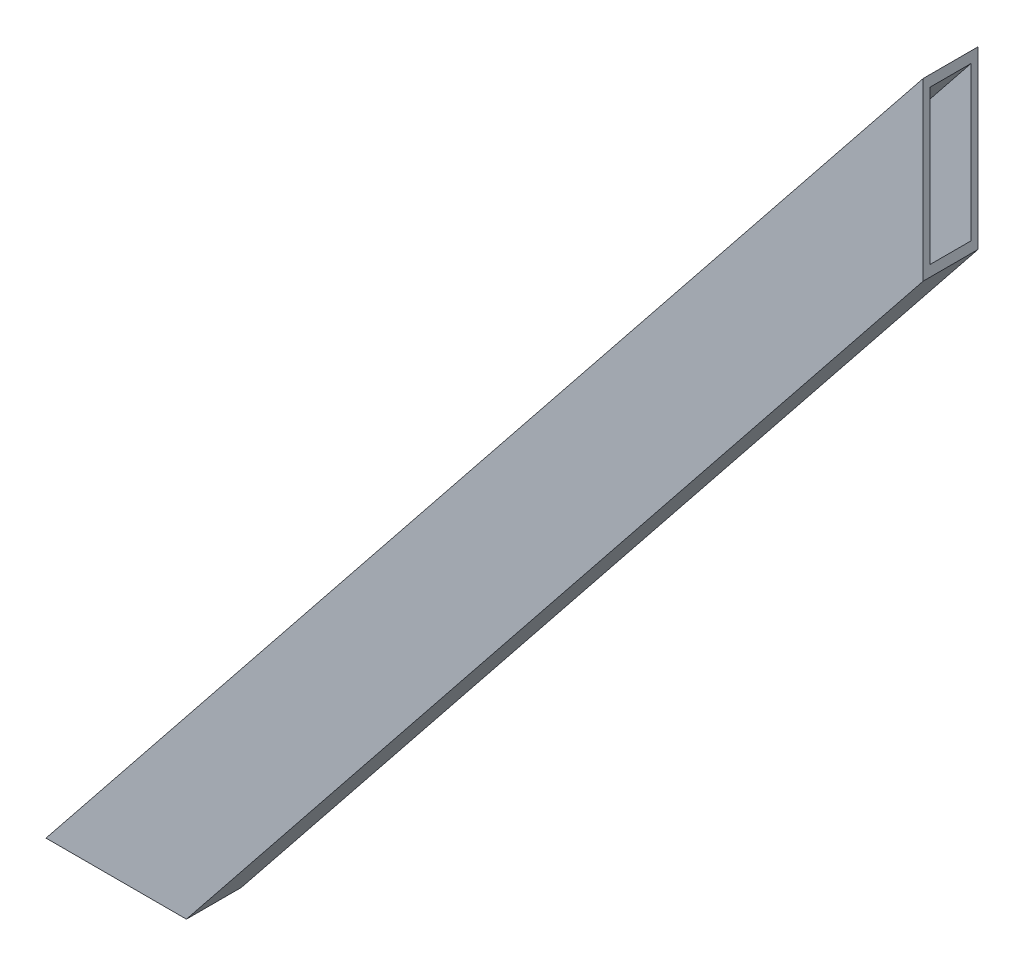
from build123d import *

# Parameters (mm, degrees)
BOSS_EXTRUDE1_DEPTH = 25.4
SHELL1_T            = -3.175
CUT_EXTRUDE1_START  = -7.62
SKETCH2_R           = 2.38125
CUT_EXTRUDE1_DEPTH  = 644.433085393
FILLET1_R           = 3.175


with BuildPart() as part:
    # Sketch1 → Boss-Extrude1 (new body)
    with BuildSketch(Plane.XY):
        Polygon((0, 0), (406.4, 508), (406.4, 426.680322185), (65.055742252, 0), align=None)
    extrude(amount=BOSS_EXTRUDE1_DEPTH)

    # Shell1
    shell1_openings = [part.faces().sort_by_distance(p)[0] for p in [
        (406.4, 467.340161092, 12.7),
        (32.527871126, 0, 12.7),
    ]]
    offset(amount=SHELL1_T, openings=shell1_openings, kind=Kind.INTERSECTION)

    # Sketch2 → Cut-Extrude1 (cut, through all)
    with BuildSketch(Plane.XY.offset(25.4).offset(CUT_EXTRUDE1_START)):
        with Locations((68.427533771, 75.369457487)):
            Circle(SKETCH2_R)
        with Locations((116.029296395, 134.871660767)):
            Circle(SKETCH2_R)
        with Locations((163.631059019, 194.373864047)):
            Circle(SKETCH2_R)
        with Locations((193.382160659, 170.572982735)):
            Circle(SKETCH2_R)
        with Locations((145.780398035, 111.070779455)):
            Circle(SKETCH2_R)
        with Locations((98.178635411, 51.568576176)):
            Circle(SKETCH2_R)
        with Locations((344.121075633, 358.996626453)):
            Circle(SKETCH2_R)
        with Locations((296.51931301, 299.494423174)):
            Circle(SKETCH2_R)
        with Locations((248.917550386, 239.992219894)):
            Circle(SKETCH2_R)
        with Locations((219.166448746, 263.793101206)):
            Circle(SKETCH2_R)
        with Locations((266.76821137, 323.295304486)):
            Circle(SKETCH2_R)
        with Locations((314.369973994, 382.797507765)):
            Circle(SKETCH2_R)
        with Locations((191.398753883, 229.083482626)):
            Circle(SKETCH2_R)
        with Locations((221.149855522, 205.282601314)):
            Circle(SKETCH2_R)
        Polygon((90.740860001, 49.386828722), (344.616927327, 366.73191288), (321.807749404, 384.979255219), (67.931682077, 67.634171061), align=None)
    extrude(amount=-CUT_EXTRUDE1_DEPTH, mode=Mode.SUBTRACT)

    # Fillet1
    fillet1_edges = [part.edges().sort_by_distance(p)[0] for p in [
        (90.740860001, 49.386828722, 1.5875),
        (67.931682077, 67.634171061, 1.5875),
        (321.807749404, 384.979255219, 1.5875),
        (344.616927327, 366.73191288, 1.5875),
    ]]
    fillet(fillet1_edges, radius=FILLET1_R)


solid = part.part
